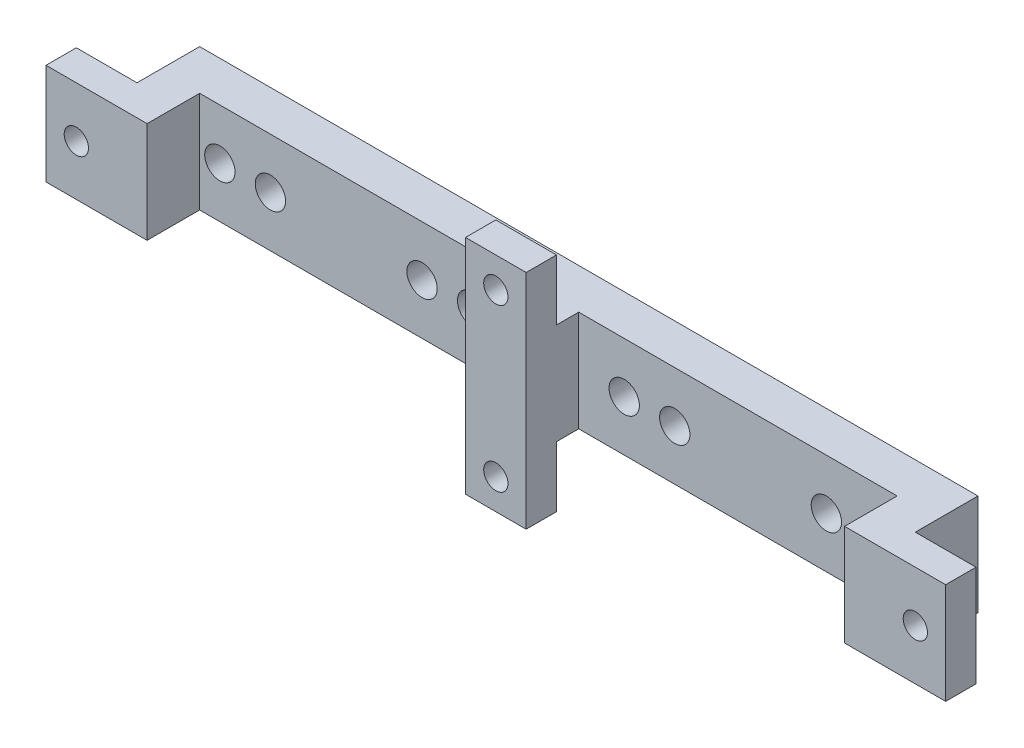
from build123d import *

# Parameters (mm, degrees)
SKETCH_1_W          = 34.5
SKETCH_1_H          = 5
EXTRUDE_1_DEPTH     = 2
SKETCH_1_9_R        = 0.75
CUT_EXTRUDE_1_DEPTH = 18.54458606
SKETCH_1_10_W       = 2
SKETCH_1_10_H       = 5
SKETCH_1_10_W_2     = 3
SKETCH_1_10_H_2     = 2.5
EXTRUDE_2_DEPTH     = 4.6
EXTRUDE_START       = 4.6
SKETCH_1_12_W       = 3
SKETCH_1_12_H       = 3
SKETCH_1_12_R       = 0.6
SKETCH_1_12_H_2     = 5
EXTRUDE_3_DEPTH     = 1.5


with BuildPart() as part:
    # 草图1 → 凸台-拉伸1 (new body)
    with BuildSketch(Plane.XY):
        Rectangle(SKETCH_1_W, SKETCH_1_H)
    extrude(amount=EXTRUDE_1_DEPTH)

    # 草图1<9> → 切除-拉伸1 (cut, through all)
    with BuildSketch(Plane.XY):
        with Locations((-16.25, 0)):
            Circle(SKETCH_1_9_R)
        with Locations((-13.75, 0)):
            Circle(SKETCH_1_9_R)
        with Locations((-6.25, 0)):
            Circle(SKETCH_1_9_R)
        with Locations((-3.75, 0)):
            Circle(SKETCH_1_9_R)
        with Locations((3.75, 0)):
            Circle(SKETCH_1_9_R)
        with Locations((6.25, 0)):
            Circle(SKETCH_1_9_R)
        with Locations((13.75, 0)):
            Circle(SKETCH_1_9_R)
        with Locations((16.25, 0)):
            Circle(SKETCH_1_9_R)
    extrude(amount=CUT_EXTRUDE_1_DEPTH, mode=Mode.SUBTRACT)

    # 草图1<10> → 凸台-拉伸2 (add)
    with BuildSketch(Plane.XY):
        with Locations((-18.25, 0)):
            Rectangle(SKETCH_1_10_W, SKETCH_1_10_H)
        with Locations((18.25, 0)):
            Rectangle(SKETCH_1_10_W, SKETCH_1_10_H)
        with Locations((0, 1.25)):
            Rectangle(SKETCH_1_10_W_2, SKETCH_1_10_H_2)
        with Locations((0, -1.25)):
            Rectangle(SKETCH_1_10_W_2, SKETCH_1_10_H_2)
    extrude(amount=EXTRUDE_2_DEPTH)

    # 草图1<12> → 凸台-拉伸3 (add)
    # profile 1 of 4: a face of its own
    with BuildSketch(Plane.XY.offset(EXTRUDE_START)):
        with Locations((0, 4)):
            Rectangle(SKETCH_1_12_W, SKETCH_1_12_H)
        with Locations((0, 4)):
            Circle(SKETCH_1_12_R, mode=Mode.SUBTRACT)
    # profile 2 of 4: a face of its own
    with BuildSketch(Plane.XY.offset(EXTRUDE_START)):
        with Locations((-20.75, 0)):
            Rectangle(SKETCH_1_12_W, SKETCH_1_12_H_2)
        with Locations((-20.75, 0)):
            Circle(SKETCH_1_12_R, mode=Mode.SUBTRACT)
    # profile 3 of 4: a face of its own
    with BuildSketch(Plane.XY.offset(EXTRUDE_START)):
        with Locations((0, -4)):
            Rectangle(SKETCH_1_12_W, SKETCH_1_12_H)
        with Locations((0, -4)):
            Circle(SKETCH_1_12_R, mode=Mode.SUBTRACT)
    # profile 4 of 4: a face of its own
    with BuildSketch(Plane.XY.offset(EXTRUDE_START)):
        with Locations((20.75, 0)):
            Rectangle(SKETCH_1_12_W, SKETCH_1_12_H_2)
        with Locations((20.75, 0)):
            Circle(SKETCH_1_12_R, mode=Mode.SUBTRACT)
    extrude(amount=-EXTRUDE_3_DEPTH)


solid = part.part
